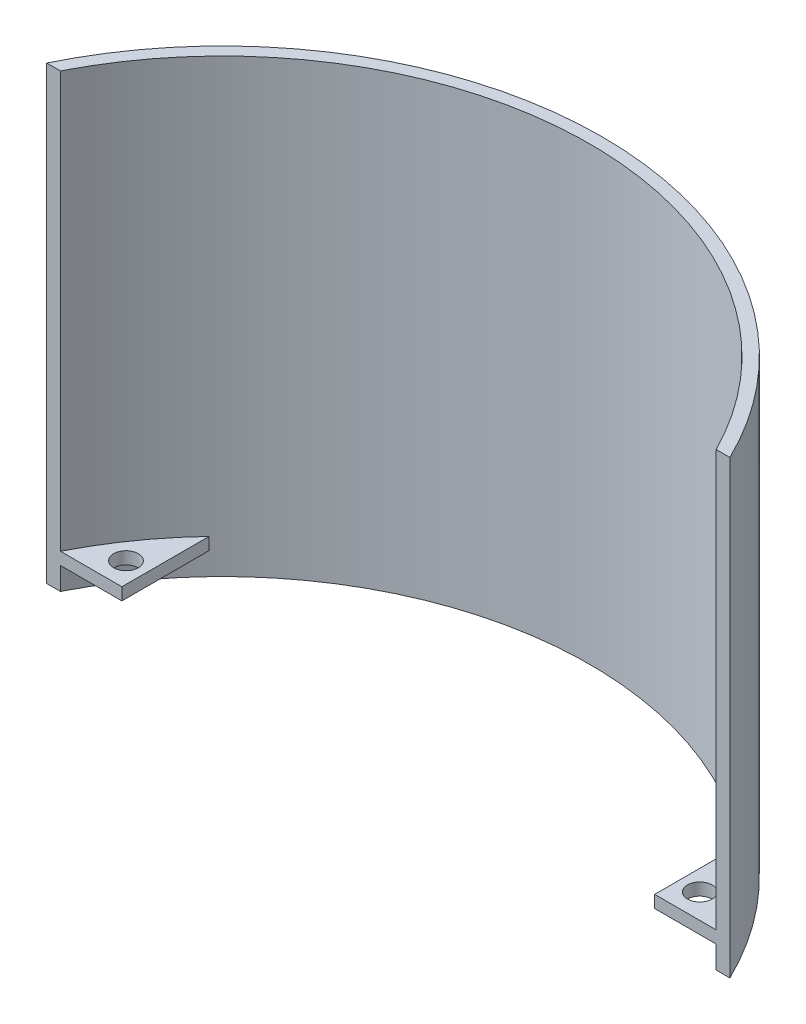
from build123d import *

# Parameters (mm, degrees)
BOSS_EXTRUDE1_DEPTH = 110
BOSS_EXTRUDE2_START = 5.5
SKETCH2_R           = 3
BOSS_EXTRUDE2_DEPTH = 3


with BuildPart() as part:
    # Sketch1 → Boss-Extrude1 (new body)
    with BuildSketch(Plane(origin=(0, 0, 0), x_dir=(1, 0, 0), z_dir=(0, 1, 0))):
        with BuildLine():
            Line((-80, 40.483522574), (-83.3484253, 40.483522574))
            ThreePointArc((-83.3484253, 40.483522574), (0, 92.66), (83.3484253, 40.483522574))
            Line((83.3484253, 40.483522574), (80, 40.483522574))
            ThreePointArc((80, 40.483522574), (0, 89.66), (-80, 40.483522574))
        make_face()
    extrude(amount=BOSS_EXTRUDE1_DEPTH)

    # Sketch2 → Boss-Extrude2 (add)
    # profile 1 of 2: a face of its own
    with BuildSketch(Plane(origin=(0, 0, 0), x_dir=(1, 0, 0), z_dir=(0, 1, 0)).offset(BOSS_EXTRUDE2_START)):
        with BuildLine():
            Line((-80, 40.483522574), (-65, 40.483522574))
            Line((-65, 40.483522574), (-65, 61.756907306))
            ThreePointArc((-65, 61.756907306), (-73.276116331, 51.667459542), (-80, 40.483522574))
        make_face()
        with Locations(Location((-70, 46.483522574, 0), (0, 0, 270))):
            Circle(SKETCH2_R, mode=Mode.SUBTRACT)
    # profile 2 of 2: a face of its own
    with BuildSketch(Plane(origin=(0, 0, 0), x_dir=(1, 0, 0), z_dir=(0, 1, 0)).offset(BOSS_EXTRUDE2_START)):
        with BuildLine():
            Line((80, 40.483522574), (65, 40.483522574))
            Line((65, 40.483522574), (65, 61.756907306))
            ThreePointArc((65, 61.756907306), (73.276116331, 51.667459542), (80, 40.483522574))
        make_face()
        with Locations(Location((70, 46.483522574, 0), (0, 0, 270))):
            Circle(SKETCH2_R, mode=Mode.SUBTRACT)
    extrude(amount=BOSS_EXTRUDE2_DEPTH)


solid = part.part
